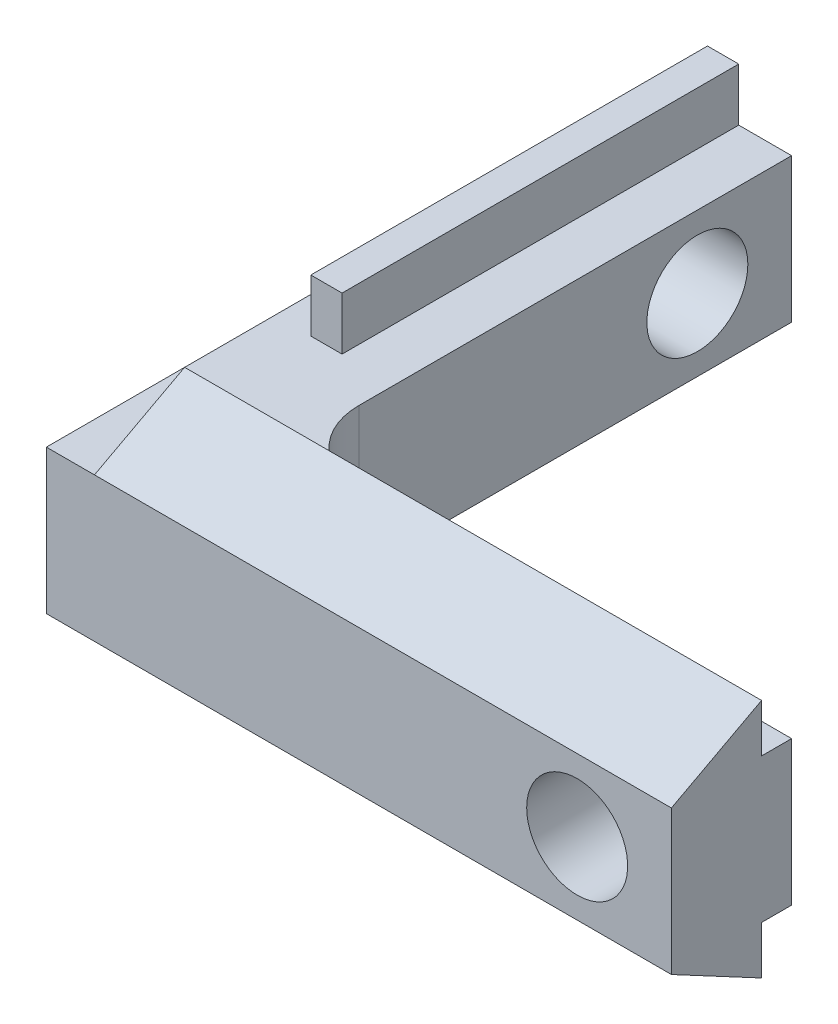
from build123d import *

# Parameters (mm, degrees)
BOSS_EXTRUDE1_DEPTH = 6
SKETCH3_W           = 1.3
SKETCH3_H           = 16.5
BOSS_EXTRUDE2_DEPTH = 2.2
SKETCH4_W           = 1.3
SKETCH4_H           = 16.5
BOSS_EXTRUDE3_DEPTH = 2.2
BOSS_EXTRUDE4_DEPTH = 24
FILLET1_R           = 3
SKETCH6_R           = 2.1
CUT_EXTRUDE1_DEPTH  = 24
SKETCH7_R           = 2.1
CUT_EXTRUDE2_DEPTH  = 24


with BuildPart() as part:
    # Sketch1 → Boss-Extrude1 (new body)
    with BuildSketch(Plane(origin=(0, 0, 0), x_dir=(1, 0, 0), z_dir=(0, 1, 0))):
        Polygon((0, 0), (0, 26), (5, 26), (5, 5), (26, 5), (26, 0), align=None)
    extrude(amount=BOSS_EXTRUDE1_DEPTH)

    # Sketch3 → Boss-Extrude2 (add)
    with BuildSketch(Plane(origin=(0, 6, 0), x_dir=(1, 0, 0), z_dir=(0, 1, 0))):
        with Locations((2.15, 17.75)):
            Rectangle(SKETCH3_W, SKETCH3_H)
    extrude(amount=BOSS_EXTRUDE2_DEPTH)

    # Sketch4 → Boss-Extrude3 (add)
    with BuildSketch(Plane.XZ):
        with Locations((2.15, -17.75)):
            Rectangle(SKETCH4_W, SKETCH4_H)
    extrude(amount=BOSS_EXTRUDE3_DEPTH)

    # Sketch5 → Boss-Extrude4 (add)
    with BuildSketch(Plane(origin=(26, 0, 0), x_dir=(0, 0, -1), z_dir=(1, 0, 0))):
        Polygon((3.75, 6), (3.75, 8), (0, 6), align=None)
        Polygon((3.75, 0), (3.75, -2), (0, 0), align=None)
    extrude(amount=-BOSS_EXTRUDE4_DEPTH)

    # Fillet1
    fillet1_edges = [part.edges().sort_by_distance(p)[0] for p in [
        (5, 3, -5),
    ]]
    fillet(fillet1_edges, radius=FILLET1_R)

    # Sketch6 → Cut-Extrude1 (cut)
    with BuildSketch(Plane(origin=(0, 0, -5), x_dir=(-1, 0, 0), z_dir=(0, 0, -1))):
        with Locations((-22.079, 3)):
            Circle(SKETCH6_R)
    extrude(amount=-CUT_EXTRUDE1_DEPTH, mode=Mode.SUBTRACT)

    # Sketch7 → Cut-Extrude2 (cut)
    with BuildSketch(Plane(origin=(5, 0, 0), x_dir=(0, 0, -1), z_dir=(1, 0, 0))):
        with Locations((22.079, 3)):
            Circle(SKETCH7_R)
    extrude(amount=-CUT_EXTRUDE2_DEPTH, mode=Mode.SUBTRACT)


solid = part.part
